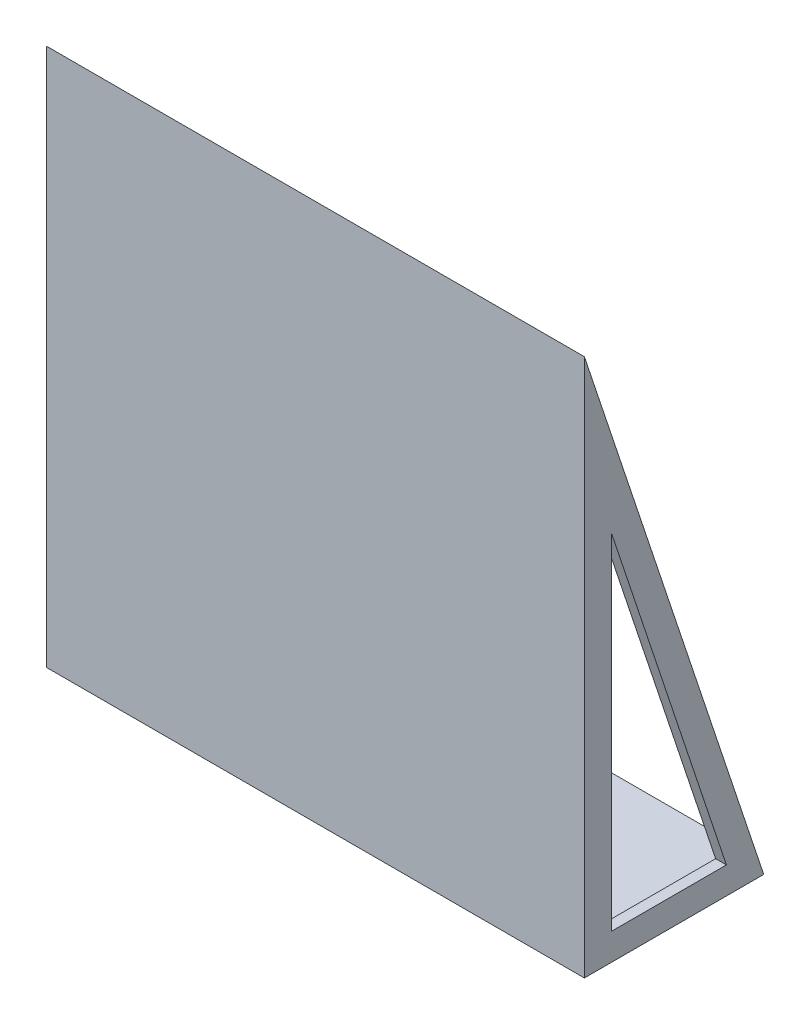
from build123d import *

# Parameters (mm, degrees)
SKETCH1_W           = 300
SKETCH1_H           = 300
BOSS_EXTRUDE1_DEPTH = 100
SKETCH4_W           = 288
SKETCH4_H           = 94
CUT_EXTRUDE1_DEPTH  = 290
CUT_EXTRUDE2_DEPTH  = 309.1
CUT_EXTRUDE3_DEPTH  = 309.1
SCALE1_SCALE        = 0.001


with BuildPart() as part:
    # Sketch1 → Boss-Extrude1 (new body)
    with BuildSketch(Plane.XY):
        Rectangle(SKETCH1_W, SKETCH1_H)
    extrude(amount=-BOSS_EXTRUDE1_DEPTH)

    # Sketch4 → Cut-Extrude1 (cut)
    with BuildSketch(Plane(origin=(0, 150, 0), x_dir=(1, 0, 0), z_dir=(0, 1, 0))):
        with Locations((0, 53)):
            Rectangle(SKETCH4_W, SKETCH4_H)
    extrude(amount=-CUT_EXTRUDE1_DEPTH, mode=Mode.SUBTRACT)

    # Sketch3 → Cut-Extrude2 (cut)
    with BuildSketch(Plane.ZY.offset(150)):
        Polygon((-100, 150), (-100, -150), (0, 150), align=None)
    extrude(amount=-CUT_EXTRUDE2_DEPTH, mode=Mode.SUBTRACT)

    # Sketch5 → Cut-Extrude3 (cut)
    with BuildSketch(Plane.ZY.offset(150)):
        Polygon((-15, -135), (-15, 57.565835097), (-79.188611699, -135), align=None)
    extrude(amount=-CUT_EXTRUDE3_DEPTH, mode=Mode.SUBTRACT)


with BuildPart() as part_1:
    # Scale1: scaled about (0, 0, 0)
    add(part.part.scale(SCALE1_SCALE))


solid = part_1.part
